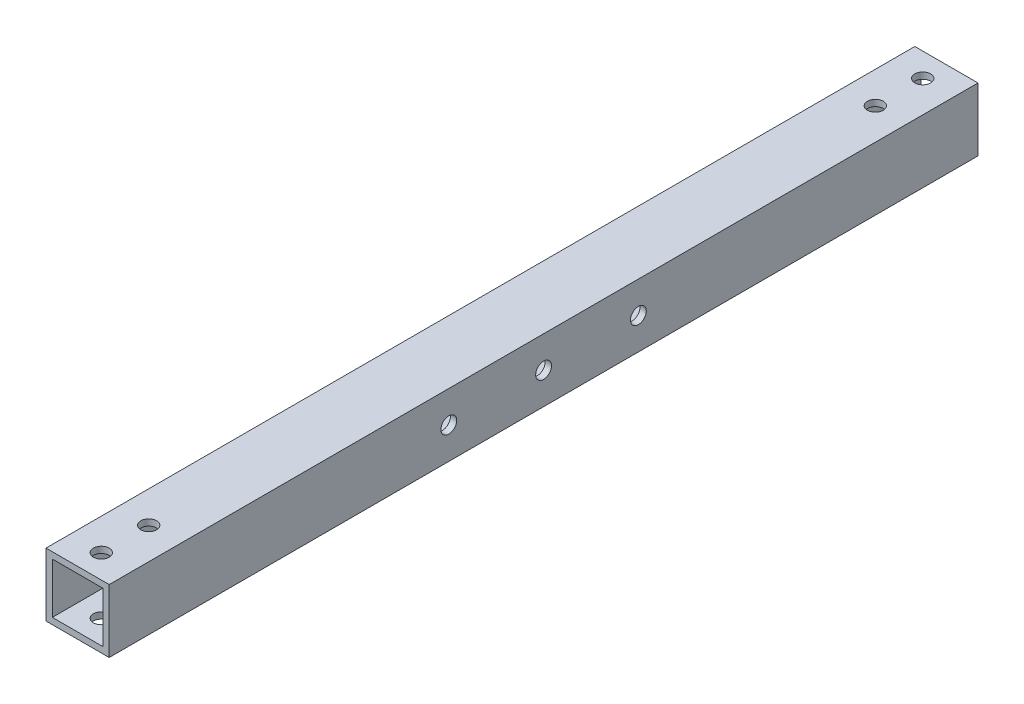
from build123d import *

# Parameters (mm, degrees)
SKETCH_1_W          = 20
SKETCH_1_H          = 20
SKETCH_1_W_2        = 16
SKETCH_1_H_2        = 16
EXTRUDE_1_DEPTH     = 275
SKETCH_3_R          = 2.5
CUT_EXTRUDE_2_DEPTH = 276.907593226
SKETCH_4_R          = 2.5
CUT_EXTRUDE_3_DEPTH = 276.907593226


with BuildPart() as part:
    # 草图1 → 凸台-拉伸1 (new body)
    with BuildSketch(Plane.XY):
        Rectangle(SKETCH_1_W, SKETCH_1_H)
        Rectangle(SKETCH_1_W_2, SKETCH_1_H_2, mode=Mode.SUBTRACT)
    extrude(amount=EXTRUDE_1_DEPTH)

    # 草图3 → 切除-拉伸2 (cut, through all)
    with BuildSketch(Plane.XZ.offset(10)):
        with Locations(Location((0, 7.5, 0), (0, 0, 270))):
            Circle(SKETCH_3_R)
        with Locations(Location((0, 267.5, 0), (0, 0, 180))):
            Circle(SKETCH_3_R)
        with Locations(Location((0, 22.5, 0), (0, 0, 180))):
            Circle(SKETCH_3_R)
        with Locations(Location((0, 252.5, 0), (0, 0, 270))):
            Circle(SKETCH_3_R)
    extrude(amount=-CUT_EXTRUDE_2_DEPTH, mode=Mode.SUBTRACT)

    # 草图4 → 切除-拉伸3 (cut, through all)
    with BuildSketch(Plane.ZY.offset(10)):
        with Locations(Location((107.5, 0, 0), (0, 0, 270))):
            Circle(SKETCH_4_R)
        with Locations(Location((167.5, 0, 0), (0, 0, 90))):
            Circle(SKETCH_4_R)
        with Locations(Location((137.5, 0, 0), (0, 0, 270))):
            Circle(SKETCH_4_R)
    extrude(amount=-CUT_EXTRUDE_3_DEPTH, mode=Mode.SUBTRACT)


solid = part.part
